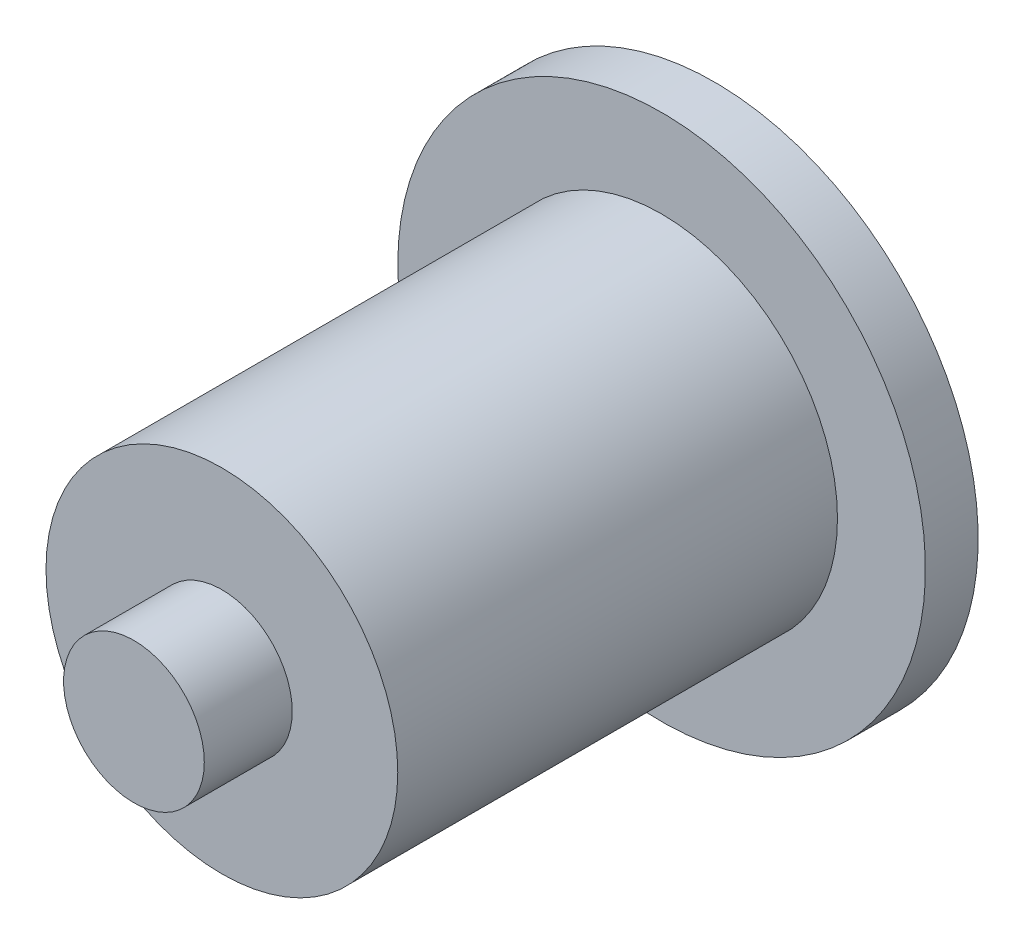
from build123d import *

# Parameters (mm, degrees)
SKETCH1_R           = 10
BOSS_EXTRUDE1_DEPTH = 25
SKETCH2_R           = 4
BOSS_EXTRUDE2_DEPTH = 5
SKETCH3_R           = 15
BOSS_EXTRUDE3_DEPTH = 3


with BuildPart() as part:
    # Sketch1 → Boss-Extrude1 (new body)
    with BuildSketch(Plane.XY):
        Circle(SKETCH1_R)
    extrude(amount=BOSS_EXTRUDE1_DEPTH)

    # Sketch2 → Boss-Extrude2 (add)
    with BuildSketch(Plane.XY.offset(25)):
        Circle(SKETCH2_R)
    extrude(amount=BOSS_EXTRUDE2_DEPTH)

    # Sketch3 → Boss-Extrude3 (add)
    with BuildSketch(Plane(origin=(0, 0, 0), x_dir=(-1, 0, 0), z_dir=(0, 0, -1))):
        Circle(SKETCH3_R)
    extrude(amount=BOSS_EXTRUDE3_DEPTH)


solid = part.part
